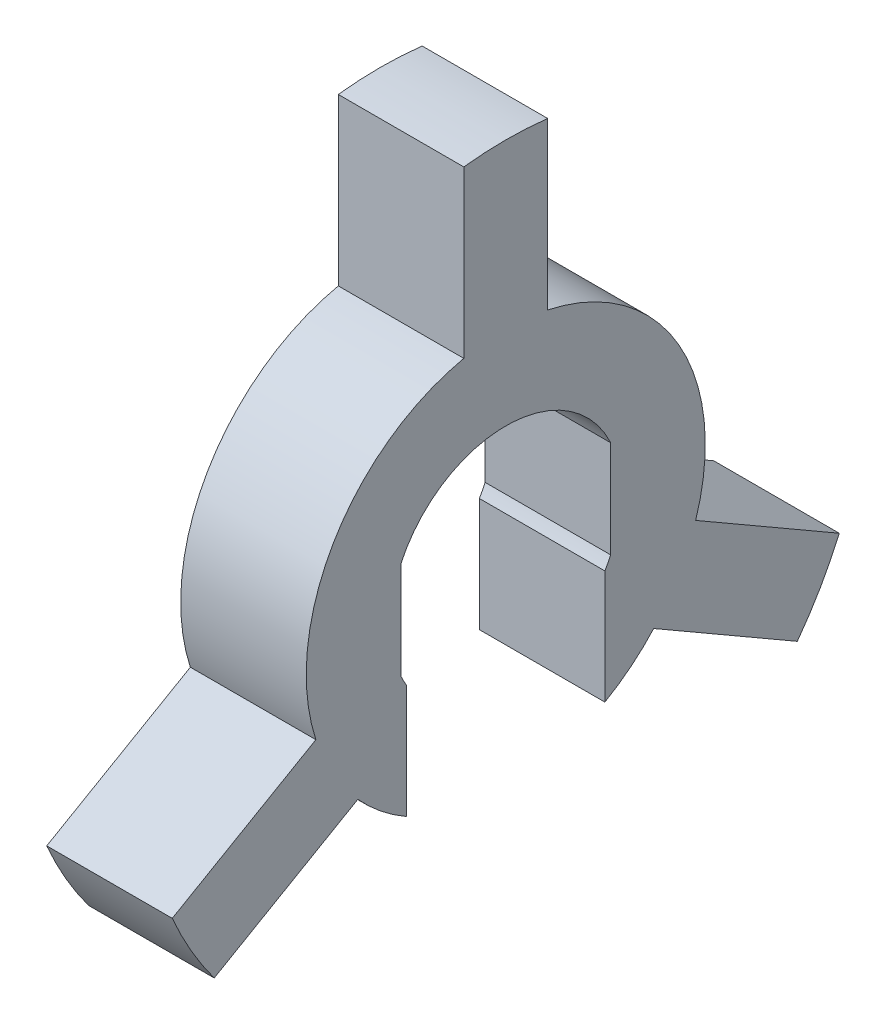
from build123d import *

# Parameters (mm, degrees)
BOSS_EXTRUDE1_DEPTH = 19


with BuildPart() as part:
    # Sketch1 → Boss-Extrude1 (new body)
    with BuildSketch(Plane(origin=(0, 0, 0), x_dir=(0, 0, -1), z_dir=(1, 0, 0))):
        with BuildLine():
            Line((15.881671826, 7.35), (15.881671826, -7.35))
            ThreePointArc((15.881671826, -7.35), (15.463231756, -8.19380642), (15, -9.013878189))
            Line((15, -9.013878189), (15, -26.211447881))
            ThreePointArc((15, -26.211447881), (18.932325741, -23.528855519), (22.394280885, -20.261692516))
            Line((22.394280885, -20.261692516), (44.130028123, -32.810832035))
            ThreePointArc((44.130028123, -32.810832035), (47.62360298, -27.4955), (50.480028123, -21.812309407))
            Line((50.480028123, -21.812309407), (28.744280885, -9.263169888))
            ThreePointArc((28.744280885, -9.263169888), (26.153967194, 15.1), (6.35, 29.524862404))
            Line((6.35, 29.524862404), (6.35, 54.623141442))
            ThreePointArc((6.35, 54.623141442), (0, 54.991), (-6.35, 54.623141442))
            Line((-6.35, 54.623141442), (-6.35, 29.524862404))
            ThreePointArc((-6.35, 29.524862404), (-26.153967194, 15.1), (-28.744280885, -9.263169888))
            Line((-28.744280885, -9.263169888), (-50.480028123, -21.812309407))
            ThreePointArc((-50.480028123, -21.812309407), (-47.62360298, -27.4955), (-44.130028123, -32.810832035))
            Line((-44.130028123, -32.810832035), (-22.394280885, -20.261692516))
            ThreePointArc((-22.394280885, -20.261692516), (-18.932325741, -23.528855519), (-15, -26.211447881))
            Line((-15, -26.211447881), (-15, -9.013878189))
            ThreePointArc((-15, -9.013878189), (-15.463231756, -8.19380642), (-15.881671826, -7.35))
            Line((-15.881671826, -7.35), (-15.881671826, 7.35))
            ThreePointArc((-15.881671826, 7.35), (0, 17.5), (15.881671826, 7.35))
        make_face()
    extrude(amount=BOSS_EXTRUDE1_DEPTH)


solid = part.part
